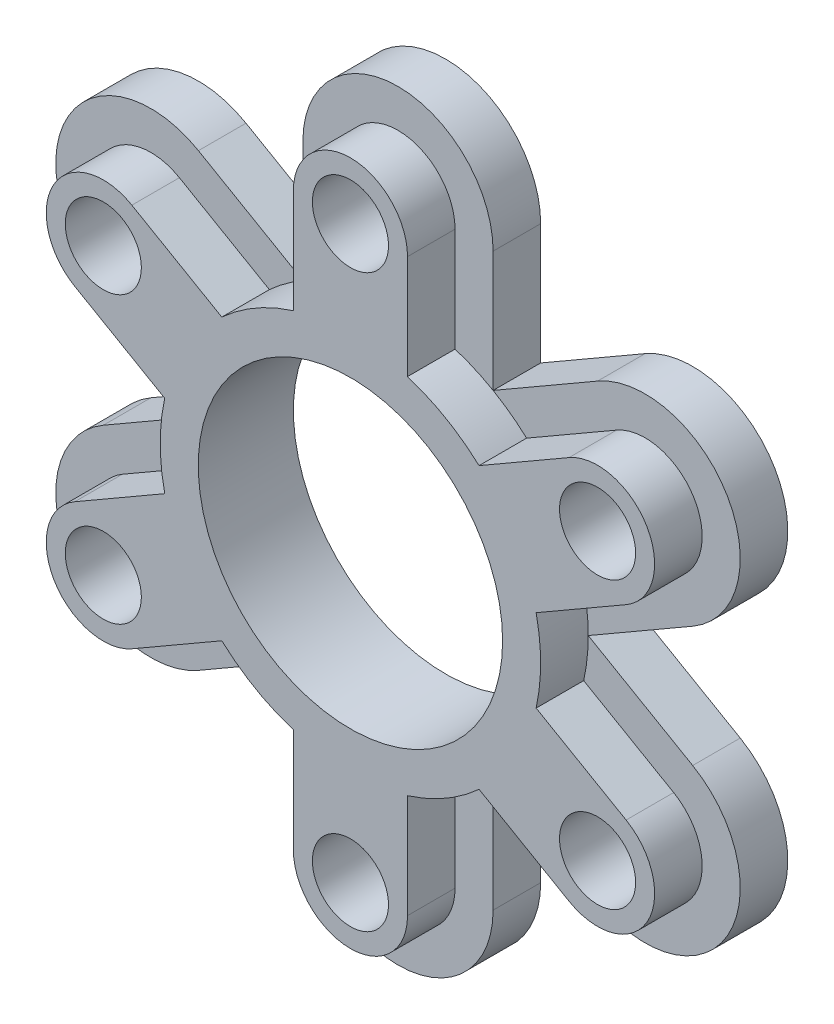
from build123d import *

# Parameters (mm, degrees)
SKETCH1_R           = 4
SKETCH1_R_2         = 16
BOSS_EXTRUDE2_DEPTH = 10
BOSS_EXTRUDE3_DEPTH = 5


with BuildPart() as part:
    # Sketch1 → Boss-Extrude2 (new body)
    with BuildSketch(Plane.XY):
        with BuildLine():
            ThreePointArc((-6, 19.078784028), (-8.048160261, 18.309208514), (-10, 17.320508076))
            ThreePointArc((-10, 17.320508076), (-11.832159566, 16.124515497), (-13.522711642, 14.735544437))
            Line((-13.522711642, 14.735544437), (-22.980762114, 20.196152423))
            ThreePointArc((-22.980762114, 20.196152423), (-31.176914536, 18), (-28.980762114, 9.803847577))
            Line((-28.980762114, 9.803847577), (-19.522711642, 4.343239591))
            ThreePointArc((-19.522711642, 4.343239591), (-19.880319827, 2.184693018), (-20, 0))
            ThreePointArc((-20, 0), (-19.880319827, -2.184693018), (-19.522711642, -4.343239591))
            Line((-19.522711642, -4.343239591), (-28.980762114, -9.803847577))
            ThreePointArc((-28.980762114, -9.803847577), (-31.176914536, -18), (-22.980762114, -20.196152423))
            Line((-22.980762114, -20.196152423), (-13.522711642, -14.735544437))
            ThreePointArc((-13.522711642, -14.735544437), (-11.832159566, -16.124515497), (-10, -17.320508076))
            ThreePointArc((-10, -17.320508076), (-8.048160261, -18.309208514), (-6, -19.078784028))
            Line((-6, -19.078784028), (-6, -30))
            ThreePointArc((-6, -30), (0, -36), (6, -30))
            Line((6, -30), (6, -19.078784028))
            ThreePointArc((6, -19.078784028), (8.048160261, -18.309208514), (10, -17.320508076))
            ThreePointArc((10, -17.320508076), (11.832159566, -16.124515497), (13.522711642, -14.735544437))
            Line((13.522711642, -14.735544437), (22.980762114, -20.196152423))
            ThreePointArc((22.980762114, -20.196152423), (31.176914536, -18), (28.980762114, -9.803847577))
            Line((28.980762114, -9.803847577), (19.522711642, -4.343239591))
            ThreePointArc((19.522711642, -4.343239591), (19.880319827, -2.184693018), (20, 0))
            ThreePointArc((20, 0), (19.880319827, 2.184693018), (19.522711642, 4.343239591))
            Line((19.522711642, 4.343239591), (28.980762114, 9.803847577))
            ThreePointArc((28.980762114, 9.803847577), (31.176914536, 18), (22.980762114, 20.196152423))
            Line((22.980762114, 20.196152423), (13.522711642, 14.735544437))
            ThreePointArc((13.522711642, 14.735544437), (11.832159566, 16.124515497), (10, 17.320508076))
            ThreePointArc((10, 17.320508076), (8.048160261, 18.309208514), (6, 19.078784028))
            Line((6, 19.078784028), (6, 30))
            ThreePointArc((6, 30), (0, 36), (-6, 30))
            Line((-6, 30), (-6, 19.078784028))
        make_face()
        with Locations((-25.980762114, -15)):
            Circle(SKETCH1_R, mode=Mode.SUBTRACT)
        with Locations((0, -30)):
            Circle(SKETCH1_R, mode=Mode.SUBTRACT)
        with Locations((25.980762114, -15)):
            Circle(SKETCH1_R, mode=Mode.SUBTRACT)
        with Locations((-25.980762114, 15)):
            Circle(SKETCH1_R, mode=Mode.SUBTRACT)
        Circle(SKETCH1_R_2, mode=Mode.SUBTRACT)
        with Locations((25.980762114, 15)):
            Circle(SKETCH1_R, mode=Mode.SUBTRACT)
        with Locations((0, 30)):
            Circle(SKETCH1_R, mode=Mode.SUBTRACT)
    extrude(amount=BOSS_EXTRUDE2_DEPTH)

    # Sketch1<4> → Boss-Extrude3 (add)
    with BuildSketch(Plane.XY):
        with BuildLine():
            ThreePointArc((10, 30), (0, 40), (-10, 30))
            Line((-10, 30), (-10, 17.320508076))
            ThreePointArc((-10, 17.320508076), (-8.048160261, 18.309208514), (-6, 19.078784028))
            Line((-6, 19.078784028), (-6, 30))
            ThreePointArc((-6, 30), (0, 36), (6, 30))
            Line((6, 30), (6, 19.078784028))
            ThreePointArc((6, 19.078784028), (8.048160261, 18.309208514), (10, 17.320508076))
            Line((10, 17.320508076), (10, 30))
        make_face()
        with BuildLine():
            ThreePointArc((-13.522711642, 14.735544437), (-11.832159566, 16.124515497), (-10, 17.320508076))
            Line((-10, 17.320508076), (-20.980762114, 23.660254038))
            ThreePointArc((-20.980762114, 23.660254038), (-34.641016151, 20), (-30.980762114, 6.339745962))
            Line((-30.980762114, 6.339745962), (-20, 0))
            ThreePointArc((-20, 0), (-19.880319827, 2.184693018), (-19.522711642, 4.343239591))
            Line((-19.522711642, 4.343239591), (-28.980762114, 9.803847577))
            ThreePointArc((-28.980762114, 9.803847577), (-31.176914536, 18), (-22.980762114, 20.196152423))
            Line((-22.980762114, 20.196152423), (-13.522711642, 14.735544437))
        make_face()
        with BuildLine():
            Line((20.980762114, 23.660254038), (10, 17.320508076))
            ThreePointArc((10, 17.320508076), (11.832159566, 16.124515497), (13.522711642, 14.735544437))
            Line((13.522711642, 14.735544437), (22.980762114, 20.196152423))
            ThreePointArc((22.980762114, 20.196152423), (31.176914536, 18), (28.980762114, 9.803847577))
            Line((28.980762114, 9.803847577), (19.522711642, 4.343239591))
            ThreePointArc((19.522711642, 4.343239591), (19.880319827, 2.184693018), (20, 0))
            Line((20, 0), (30.980762114, 6.339745962))
            ThreePointArc((30.980762114, 6.339745962), (34.641016151, 20), (20.980762114, 23.660254038))
        make_face()
        with BuildLine():
            ThreePointArc((-19.522711642, -4.343239591), (-19.880319827, -2.184693018), (-20, 0))
            Line((-20, 0), (-30.980762114, -6.339745962))
            ThreePointArc((-30.980762114, -6.339745962), (-34.641016151, -20), (-20.980762114, -23.660254038))
            Line((-20.980762114, -23.660254038), (-10, -17.320508076))
            ThreePointArc((-10, -17.320508076), (-11.832159566, -16.124515497), (-13.522711642, -14.735544437))
            Line((-13.522711642, -14.735544437), (-22.980762114, -20.196152423))
            ThreePointArc((-22.980762114, -20.196152423), (-31.176914536, -18), (-28.980762114, -9.803847577))
            Line((-28.980762114, -9.803847577), (-19.522711642, -4.343239591))
        make_face()
        with BuildLine():
            Line((30.980762114, -6.339745962), (20, 0))
            ThreePointArc((20, 0), (19.880319827, -2.184693018), (19.522711642, -4.343239591))
            Line((19.522711642, -4.343239591), (28.980762114, -9.803847577))
            ThreePointArc((28.980762114, -9.803847577), (31.176914536, -18), (22.980762114, -20.196152423))
            Line((22.980762114, -20.196152423), (13.522711642, -14.735544437))
            ThreePointArc((13.522711642, -14.735544437), (11.832159566, -16.124515497), (10, -17.320508076))
            Line((10, -17.320508076), (20.980762114, -23.660254038))
            ThreePointArc((20.980762114, -23.660254038), (34.641016151, -20), (30.980762114, -6.339745962))
        make_face()
        with BuildLine():
            ThreePointArc((-6, -19.078784028), (-8.048160261, -18.309208514), (-10, -17.320508076))
            Line((-10, -17.320508076), (-10, -30))
            ThreePointArc((-10, -30), (0, -40), (10, -30))
            Line((10, -30), (10, -17.320508076))
            ThreePointArc((10, -17.320508076), (8.048160261, -18.309208514), (6, -19.078784028))
            Line((6, -19.078784028), (6, -30))
            ThreePointArc((6, -30), (0, -36), (-6, -30))
            Line((-6, -30), (-6, -19.078784028))
        make_face()
    extrude(amount=BOSS_EXTRUDE3_DEPTH)


solid = part.part
